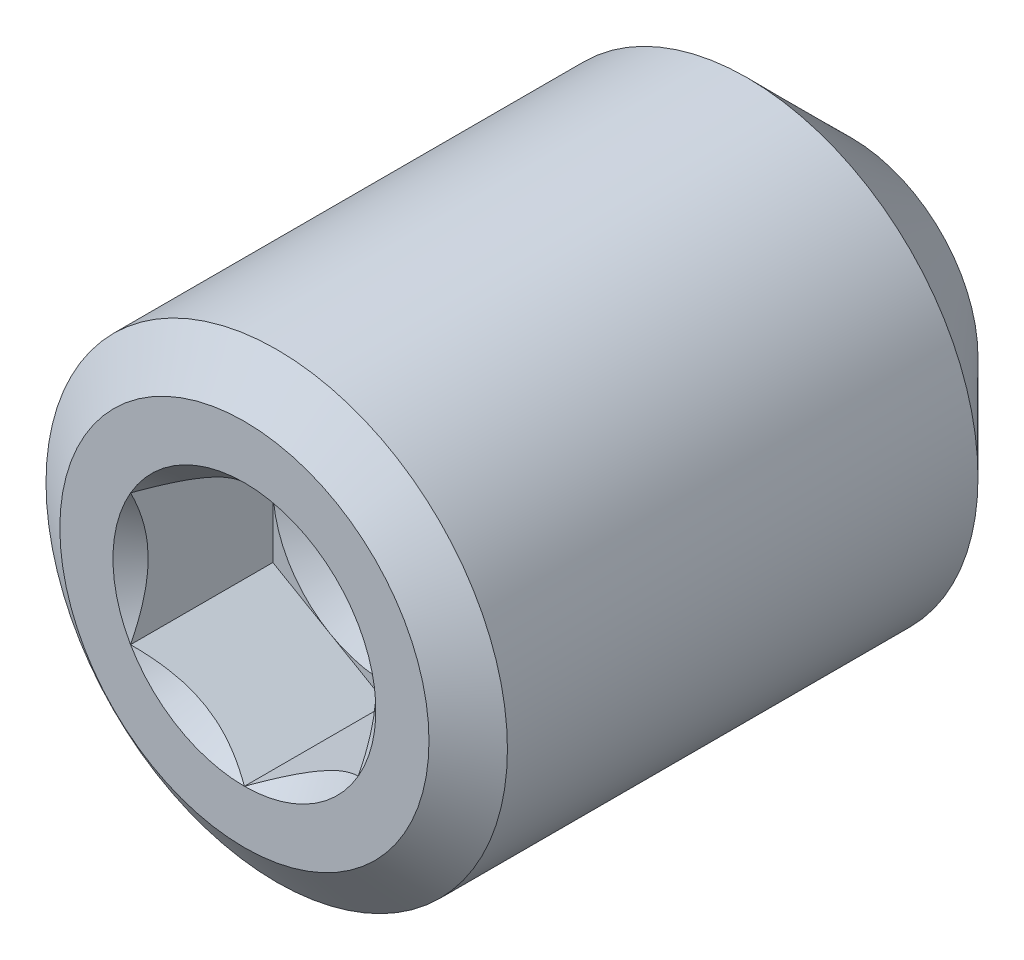
from build123d import *

# Parameters (mm, degrees)
CUT_EXTRUDE10_DEPTH = 1.48828125


with BuildPart() as part:
    # Sketch22 → Revolve1 (revolve)
    with BuildSketch(Plane(origin=(0, 0, 0), x_dir=(0, 0, -1), z_dir=(1, 0, 0))):
        Polygon((-2.777759232, 0), (-2.777759232, 1.9304), (-2.439839074, 2.413), (2.481480087, 2.413), (3.572240768, 1.322239319), (3.572240768, 0), (2.777759232, 0), align=None)
    revolve(axis=Axis((0, 0, -2.777759232), (0, 0, -1)))

    # Sketch23 → Cut-Extrude10 (cut)
    with BuildSketch(Plane.XY.offset(2.777759232)):
        Polygon((0, 1.374815329), (-1.190625, 0.687407664), (-1.190625, -0.687407664), (0, -1.374815329), (1.190625, -0.687407664), (1.190625, 0.687407664), align=None)
    extrude(amount=-CUT_EXTRUDE10_DEPTH, mode=Mode.SUBTRACT)

    # Cut-Extrude11 cone 1 section (through the dimple's axis) → Cut-Extrude11 (revolve, cut)
    with BuildSketch(Plane(origin=(0, 0, 2.777759232), x_dir=(0, -1, 0), z_dir=(1, 0, 0))):
        Polygon((0, 0), (1.374815329, 0), (0, 1.374815329), align=None)
    revolve(axis=Axis((0, 0, 2.777759232), (0, 0, -1)), mode=Mode.SUBTRACT)

    # Cut-Extrude12 cone 1 section (through the dimple's axis) → Cut-Extrude12 (revolve, cut)
    with BuildSketch(Plane(origin=(0, 0, 1.289477982), x_dir=(0, -1, 0), z_dir=(1, 0, 0))):
        Polygon((0, 0), (1.190625, 0), (0, 0.687407664), align=None)
    revolve(axis=Axis((0, 0, 1.289477982), (0, 0, -1)), mode=Mode.SUBTRACT)


solid = part.part
